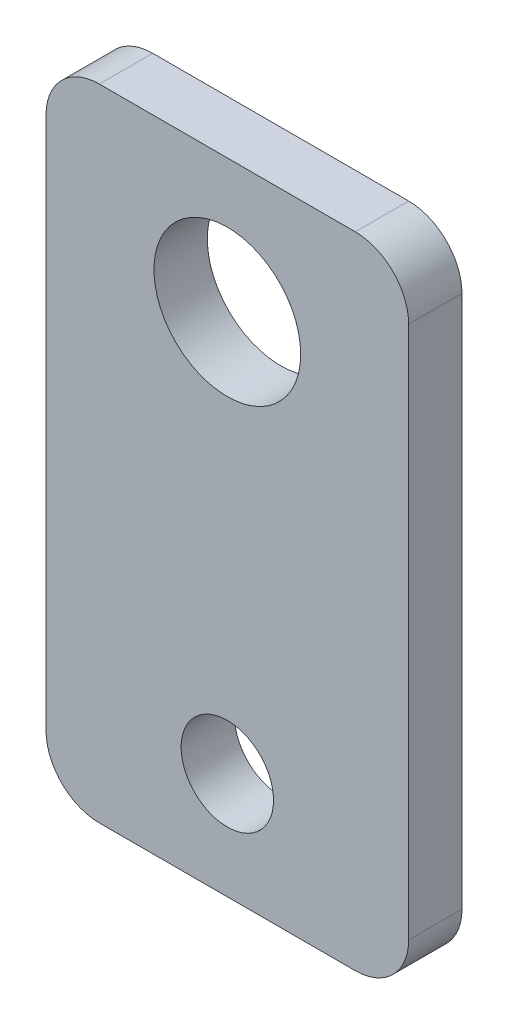
from build123d import *

# Parameters (mm, degrees)
SKETCH1_W           = 21.59
SKETCH1_H           = 38.1
SKETCH1_R           = 4.3688
SKETCH1_R_2         = 2.75082
BOSS_EXTRUDE1_DEPTH = 3.175
FILLET1_R           = 3.175


with BuildPart() as part:
    # Sketch1 → Boss-Extrude1 (new body)
    with BuildSketch(Plane.XY):
        Rectangle(SKETCH1_W, SKETCH1_H)
        with Locations((0, 11.1125)):
            Circle(SKETCH1_R, mode=Mode.SUBTRACT)
        with Locations((0, -12.7)):
            Circle(SKETCH1_R_2, mode=Mode.SUBTRACT)
    extrude(amount=BOSS_EXTRUDE1_DEPTH)

    # Fillet1
    fillet1_edges = [part.edges().sort_by_distance(p)[0] for p in [
        (10.795, -19.05, 1.5875),
        (-10.795, -19.05, 1.5875),
        (-10.795, 19.05, 1.5875),
        (10.795, 19.05, 1.5875),
    ]]
    fillet(fillet1_edges, radius=FILLET1_R)


solid = part.part
